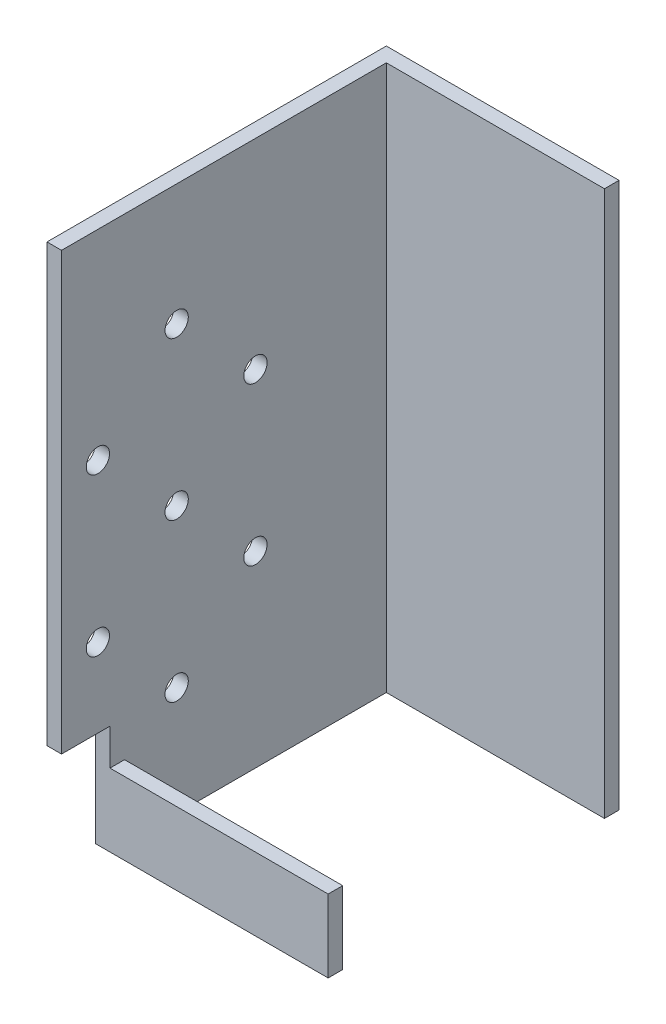
from build123d import *

# Parameters (mm, degrees)
SKETCH1_W             = 30.48
SKETCH1_H             = 57.15
BOSS_EXTRUDE1_DEPTH   = 1.524
SKETCH2_W             = 1.524
SKETCH2_H             = 57.15
SKETCH2_H_2           = 7.62
BOSS_EXTRUDE2_DEPTH   = 22.86
SKETCH3_W             = 1.524
SKETCH3_H             = 45.72
BOSS_EXTRUDE3_DEPTH   = 5.08
F_2_CLEARANCE_HOLE1_D = 2.4384


with BuildPart() as part:
    # Sketch1 → Boss-Extrude1 (new body)
    with BuildSketch(Plane(origin=(0, 0, 0), x_dir=(0, 0, -1), z_dir=(1, 0, 0))):
        with Locations((15.24, 28.575)):
            Rectangle(SKETCH1_W, SKETCH1_H)
    extrude(amount=BOSS_EXTRUDE1_DEPTH)

    # Sketch2 → Boss-Extrude2 (add)
    with BuildSketch(Plane(origin=(1.524, 0, 0), x_dir=(0, 0, -1), z_dir=(1, 0, 0))):
        with Locations((29.718, 28.575)):
            Rectangle(SKETCH2_W, SKETCH2_H)
        with Locations((0.762, 3.81)):
            Rectangle(SKETCH2_W, SKETCH2_H_2)
    extrude(amount=BOSS_EXTRUDE2_DEPTH)

    # Sketch3 → Boss-Extrude3 (add)
    with BuildSketch(Plane.XY):
        with Locations((0.762, 34.29)):
            Rectangle(SKETCH3_W, SKETCH3_H)
    extrude(amount=BOSS_EXTRUDE3_DEPTH)

    # #2 Clearance Hole1 (through all)
    with Locations(Plane(origin=(1.524, 0, 0), x_dir=(0, 0, -1), z_dir=(1, 0, 0))):
        with Locations((-1.27, 36.195), (15.24, 36.195), (6.985, 44.45), (6.985, 27.94), (6.985, 11.43), (15.24, 19.685), (-1.27, 19.685)):
            Hole(F_2_CLEARANCE_HOLE1_D / 2)


solid = part.part
